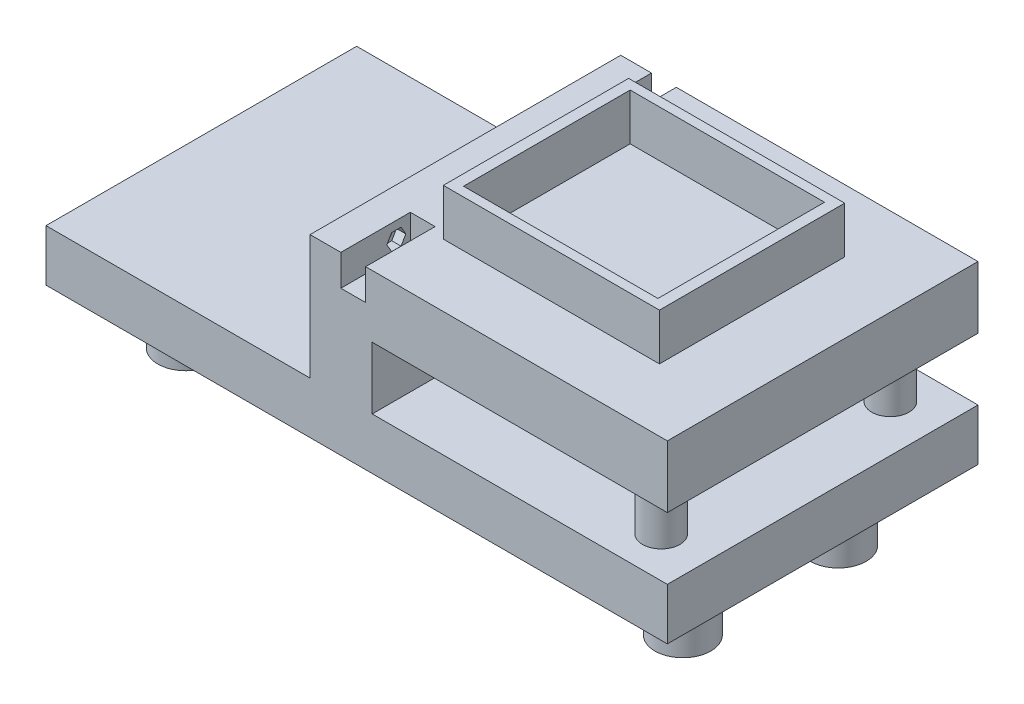
from build123d import *

# Parameters (mm, degrees)
SKETCH1_W            = 115
SKETCH1_H            = 100
BOSS_EXTRUDE1_DEPTH  = 20
SKETCH8_R            = 7
SKETCH8_R_2          = 6
BOSS_EXTRUDE4_DEPTH  = 20
SKETCH9_W            = 200
SKETCH9_H            = 100
BOSS_EXTRUDE5_DEPTH  = 16.6
SKETCH10_R           = 9
SKETCH10_R_2         = 10
BOSS_EXTRUDE7_DEPTH  = 20
SKETCH11_W           = 69.56
SKETCH11_H           = 59.638518518
SKETCH11_W_2         = 62.561838236
SKETCH11_H_2         = 53.638518518
BOSS_EXTRUDE9_DEPTH  = 15
SKETCH17_W           = 20
SKETCH17_H           = 100
BOSS_EXTRUDE15_DEPTH = 20
SKETCH15_R           = 14.1
CUT_EXTRUDE2_DEPTH   = 10
SKETCH21_R           = 1.76744544
SKETCH21_R_2         = 2.038433248
CUT_EXTRUDE3_DEPTH   = 20
SKETCH19_R           = 1.6
CUT_EXTRUDE4_DEPTH   = 38
CUT_EXTRUDE5_DEPTH   = 3
SKETCH23_W           = 7.97749669
SKETCH23_H           = 22.361861783
CUT_EXTRUDE6_DEPTH   = 10
CUT_EXTRUDE7_DEPTH   = 3
CUT_EXTRUDE8_DEPTH   = 3


with BuildPart() as part:
    # Sketch1 → Boss-Extrude1 (new body)
    with BuildSketch(Plane(origin=(0, 0, 0), x_dir=(1, 0, 0), z_dir=(0, 1, 0))):
        Rectangle(SKETCH1_W, SKETCH1_H)
    extrude(amount=BOSS_EXTRUDE1_DEPTH)

    # Sketch8 → Boss-Extrude4 (add)
    with BuildSketch(Plane.XZ):
        with Locations(Location((0, 0, 0), (0, 0, 90))):
            Circle(SKETCH8_R)
        with Locations(Location((42.407889557, -36.876425702, 0), (0, 0, 90))):
            Circle(SKETCH8_R_2)
        with Locations(Location((42.407889557, 36.876425702, 0), (0, 0, 90))):
            Circle(SKETCH8_R_2)
    extrude(amount=BOSS_EXTRUDE4_DEPTH)

    # Sketch9 → Boss-Extrude5 (add)
    with BuildSketch(Plane.XZ.offset(20)):
        with Locations((-42.5, 0)):
            Rectangle(SKETCH9_W, SKETCH9_H)
    extrude(amount=BOSS_EXTRUDE5_DEPTH)

    # Sketch10 → Boss-Extrude7 (add)
    with BuildSketch(Plane.XZ.offset(36.6)):
        with Locations(Location((37.5, -25, 0), (0, 0, 270))):
            Circle(SKETCH10_R)
        with Locations(Location((-122.5, -25, 0), (0, 0, 90))):
            Circle(SKETCH10_R)
        with Locations(Location((-122.5, 25, 0), (0, 0, 270))):
            Circle(SKETCH10_R)
        with Locations(Location((37.5, 25, 0), (0, 0, 90))):
            Circle(SKETCH10_R)
        with Locations(Location((-42.5, 0, 0), (0, 0, 270))):
            Circle(SKETCH10_R_2)
    extrude(amount=BOSS_EXTRUDE7_DEPTH)

    # Sketch11 → Boss-Extrude9 (add)
    with BuildSketch(Plane(origin=(0, 20, 0), x_dir=(1, 0, 0), z_dir=(0, 1, 0))):
        Rectangle(SKETCH11_W, SKETCH11_H)
        Rectangle(SKETCH11_W_2, SKETCH11_H_2, mode=Mode.SUBTRACT)
    extrude(amount=BOSS_EXTRUDE9_DEPTH)

    # Sketch17 → Boss-Extrude15 (add)
    with BuildSketch(Plane.XZ):
        with Locations((-47.5, 0)):
            Rectangle(SKETCH17_W, SKETCH17_H)
    extrude(amount=BOSS_EXTRUDE15_DEPTH)

    # Sketch15 → Cut-Extrude2 (cut)
    with BuildSketch(Plane(origin=(0, -20, 0), x_dir=(1, 0, 0), z_dir=(0, 1, 0))):
        with Locations(Location((-78.6, 0, 0), (0, 0, 270))):
            Circle(SKETCH15_R)
    extrude(amount=-CUT_EXTRUDE2_DEPTH, mode=Mode.SUBTRACT)

    # Sketch21 → Cut-Extrude3 (cut)
    with BuildSketch(Plane(origin=(0, -30, 0), x_dir=(1, 0, 0), z_dir=(0, 1, 0))):
        with Locations(Location((-85.16065049, 0, 0), (0, 0, 270))):
            Circle(SKETCH21_R)
        with Locations(Location((-73.222056531, 0, 0), (0, 0, 270))):
            Circle(SKETCH21_R_2)
    extrude(amount=-CUT_EXTRUDE3_DEPTH, mode=Mode.SUBTRACT)

    # Sketch19 → Cut-Extrude4 (cut)
    with BuildSketch(Plane.ZY.offset(57.5)):
        with Locations((-32.14, -13.409140004)):
            Circle(SKETCH19_R)
        with Locations((32.14, -13.409140004)):
            Circle(SKETCH19_R)
        with Locations((-32.14, 14.690859996)):
            Circle(SKETCH19_R)
        with Locations(Location((32.14, 14.690859996, 0), (0, 0, 180))):
            Circle(SKETCH19_R)
    extrude(amount=-CUT_EXTRUDE4_DEPTH, mode=Mode.SUBTRACT)

    # Sketch22 → Cut-Extrude5 (cut)
    with BuildSketch(Plane(origin=(-37.5, 0, 0), x_dir=(0, 0, -1), z_dir=(1, 0, 0))):
        Polygon((-29.09, -13.409140004), (-30.615, -10.767762522), (-33.665, -10.767762522), (-35.19, -13.409140004), (-33.665, -16.050517485), (-30.615, -16.050517485), align=None)
        Polygon((30.615, -16.050517485), (29.09, -13.409140004), (30.615, -10.767762522), (33.665, -10.767762522), (35.19, -13.409140004), (33.665, -16.050517485), align=None)
    extrude(amount=-CUT_EXTRUDE5_DEPTH, mode=Mode.SUBTRACT)

    # Sketch23 → Cut-Extrude6 (cut)
    with BuildSketch(Plane(origin=(0, 20, 0), x_dir=(1, 0, 0), z_dir=(0, 1, 0))):
        with Locations((-43.602813804, -38.819069109)):
            Rectangle(SKETCH23_W, SKETCH23_H)
        with Locations((-43.602813804, 38.819069109)):
            Rectangle(SKETCH23_W, SKETCH23_H)
    extrude(amount=-CUT_EXTRUDE6_DEPTH, mode=Mode.SUBTRACT)

    # Sketch24 → Cut-Extrude7 (cut)
    with BuildSketch(Plane(origin=(-47.591562149, 0, 0), x_dir=(0, 0, -1), z_dir=(1, 0, 0))):
        Polygon((-33.665, 17.332237478), (-35.19, 14.690859996), (-33.665, 12.049482515), (-30.615, 12.049482515), (-29.09, 14.690859996), (-30.615, 17.332237478), align=None)
    extrude(amount=-CUT_EXTRUDE7_DEPTH, mode=Mode.SUBTRACT)

    # Sketch25 → Cut-Extrude8 (cut)
    with BuildSketch(Plane(origin=(-47.591562149, 0, 0), x_dir=(0, 0, -1), z_dir=(1, 0, 0))):
        Polygon((35.19, 14.690859996), (33.665, 17.332237478), (30.615, 17.332237478), (29.09, 14.690859996), (30.615, 12.049482515), (33.665, 12.049482515), align=None)
    extrude(amount=-CUT_EXTRUDE8_DEPTH, mode=Mode.SUBTRACT)


solid = part.part
